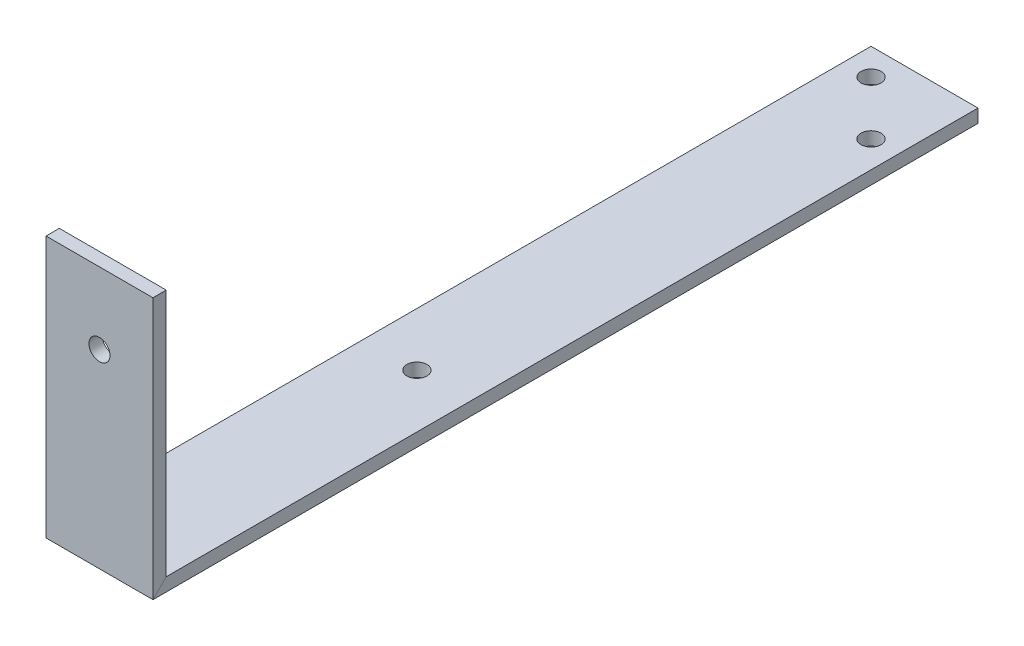
from build123d import *

# Parameters (mm, degrees)
CROQUIS2_W              = 50.8
CROQUIS2_H              = 6.31
CROQUIS3_W              = 50.8
CROQUIS3_H              = 6.31
CROQUIS4_W              = 60
CROQUIS4_H              = 53.155
SALIENTE_EXTRUIR1_DEPTH = 6.31
CROQUIS5_W              = 60
CROQUIS5_H              = 6.31
CORTAR_EXTRUIR1_DEPTH   = 6.31
CORTAR_EXTRUIR2_DEPTH   = 634
CROQUIS8_W              = 50.8
CROQUIS8_H              = 6.31
SALIENTE_EXTRUIR2_DEPTH = 63.5
CROQUIS9_R              = 5
CORTAR_EXTRUIR3_DEPTH   = 10
CROQUIS10_W             = 790.847933
CROQUIS10_H             = 6.31
CORTAR_EXTRUIR4_DEPTH   = 286
CROQUIS11_W             = 50.8
CROQUIS11_H             = 6.31
CROQUIS11_W_2           = 210
CORTAR_EXTRUIR5_DEPTH   = 13.11
CROQUIS12_W             = 50.8
CROQUIS12_H             = 6.31
SALIENTE_EXTRUIR3_DEPTH = 6.35
CROQUIS13_W             = 50.8
CROQUIS13_H             = 6.35
CORTAR_EXTRUIR6_DEPTH   = 6.35
CROQUIS14_W             = 85.847108528
CROQUIS14_H             = 473.639219469
CORTAR_EXTRUIR7_DEPTH   = 137
CROQUIS15_R             = 4.7625
CORTAR_EXTRUIR8_DEPTH   = 33
CROQUIS16_R             = 5
CORTAR_EXTRUIR9_DEPTH   = 33
CROQUIS18_R             = 4.7625
CORTAR_EXTRUIR10_DEPTH  = 50


with BuildPart() as part:
    # Barrer1: sweep along a curve in space
    with BuildLine() as barrer1_path:
        Line((0, 0, 0), (0, -567.24, 0))
        Line((0, -567.24, 0), (0, -567.24, 336.2))
        Line((0, -567.24, 336.2), (1786.7, -567.24, 336.2))
        Line((1786.7, -567.24, 336.2), (1786.7, -567.24, 693.16))
        Line((1786.7, -567.24, 693.16), (1786.7, -436.23, 693.16))
        Line((1786.7, -436.23, 693.16), (1786.7, -436.23, 1487.162933))
    # Croquis2 → Barrer1 (sweep)
    with BuildSketch(Plane(origin=(0, 0, 0), x_dir=(1, 0, 0), z_dir=(0, 1, 0))):
        Rectangle(CROQUIS2_W, CROQUIS2_H)
        with Locations((210, 0)):
            Rectangle(CROQUIS2_W, CROQUIS2_H)
    sweep(path=barrer1_path.line, transition=Transition.RIGHT)

    # Barrer4: sweep along a curve in space
    with BuildLine() as barrer4_path:
        Line((-0.201028049, -3.155, -3.155), (-0.201028049, -3.155, -207.155))
        Line((-0.201028049, -3.155, -207.155), (-0.201028049, -53.155, -207.155))
    # Croquis3 → Barrer4 (sweep)
    with BuildSketch(Plane(origin=(0, 0, -3.155), x_dir=(-1, 0, 0), z_dir=(0, 0, -1))):
        with Locations((-210, -3.155)):
            Rectangle(CROQUIS3_W, CROQUIS3_H)
        with Locations((0, -3.155)):
            Rectangle(CROQUIS3_W, CROQUIS3_H)
    sweep(path=barrer4_path.line, transition=Transition.RIGHT)

    # Croquis4 → Saliente-Extruir1 (add)
    with BuildSketch(Plane(origin=(0, 0, -210.31), x_dir=(-1, 0, 0), z_dir=(0, 0, -1))):
        with Locations((-154.6, -26.5775)):
            Rectangle(CROQUIS4_W, CROQUIS4_H)
    extrude(amount=-SALIENTE_EXTRUIR1_DEPTH)

    # Croquis5 → Cortar-Extruir1 (cut)
    with BuildSketch(Plane.XY.offset(-204)):
        with Locations((154.6, -3.155)):
            Rectangle(CROQUIS5_W, CROQUIS5_H)
    extrude(amount=-CORTAR_EXTRUIR1_DEPTH, mode=Mode.SUBTRACT)

    # Croquis7 → Cortar-Extruir2 (cut)
    with BuildSketch(Plane(origin=(0, 0, 0), x_dir=(1, 0, 0), z_dir=(0, 1, 0))):
        Polygon((1761.3, -361.6), (2022.1, -361.6), (2022.1, 278.600557529), (-188.115947115, 278.600557529), (-188.115947115, -361.6), align=None)
    extrude(amount=-CORTAR_EXTRUIR2_DEPTH, mode=Mode.SUBTRACT)

    # Croquis8 → Saliente-Extruir2 (add)
    with BuildSketch(Plane(origin=(0, 0, 361.6), x_dir=(-1, 0, 0), z_dir=(0, 0, -1))):
        with Locations((-1786.7, -567.24)):
            Rectangle(CROQUIS8_W, CROQUIS8_H)
    extrude(amount=SALIENTE_EXTRUIR2_DEPTH)

    # Croquis9 → Cortar-Extruir3 (cut)
    with BuildSketch(Plane(origin=(0, -433.075, 0), x_dir=(1, 0, 0), z_dir=(0, 1, 0))):
        with Locations(Location((1786.7, -1454.162933, 0), (0, 0, 270))):
            Circle(CROQUIS9_R)
        with Locations(Location((1786.7, -1234.162933, 0), (0, 0, 270))):
            Circle(CROQUIS9_R)
        with Locations(Location((1996.7, -1234.162933, 0), (0, 0, 270))):
            Circle(CROQUIS9_R)
        with Locations(Location((1996.7, -1454.162933, 0), (0, 0, 270))):
            Circle(CROQUIS9_R)
    extrude(amount=-CORTAR_EXTRUIR3_DEPTH, mode=Mode.SUBTRACT)

    # Croquis10 → Cortar-Extruir4 (cut)
    with BuildSketch(Plane(origin=(2022.1, 0, 0), x_dir=(0, 0, -1), z_dir=(1, 0, 0))):
        with Locations((-1091.7389665, -436.23)):
            Rectangle(CROQUIS10_W, CROQUIS10_H)
    extrude(amount=-CORTAR_EXTRUIR4_DEPTH, mode=Mode.SUBTRACT)

    # Croquis11 → Cortar-Extruir5 (cut)
    with BuildSketch(Plane(origin=(0, -433.075, 0), x_dir=(1, 0, 0), z_dir=(0, 1, 0))):
        with Locations((1996.7, -693.16)):
            Rectangle(CROQUIS11_W, CROQUIS11_H)
        with Locations((1866.3, -693.16)):
            Rectangle(CROQUIS11_W_2, CROQUIS11_H)
    extrude(amount=-CORTAR_EXTRUIR5_DEPTH, mode=Mode.SUBTRACT)

    # Croquis12 → Saliente-Extruir3 (add)
    with BuildSketch(Plane(origin=(0, 0, 361.6), x_dir=(-1, 0, 0), z_dir=(0, 0, -1))):
        with Locations((-1996.7, -567.24)):
            Rectangle(CROQUIS12_W, CROQUIS12_H)
    extrude(amount=SALIENTE_EXTRUIR3_DEPTH)

    # Croquis13 → Cortar-Extruir6 (cut)
    with BuildSketch(Plane(origin=(0, -564.085, 0), x_dir=(1, 0, 0), z_dir=(0, 1, 0))):
        with Locations((1786.7, -301.275)):
            Rectangle(CROQUIS13_W, CROQUIS13_H)
    extrude(amount=-CORTAR_EXTRUIR6_DEPTH, mode=Mode.SUBTRACT)

    # Croquis14 → Cortar-Extruir7 (cut)
    with BuildSketch(Plane(origin=(0, -446.185, 0), x_dir=(1, 0, 0), z_dir=(0, 1, 0))):
        with Locations((1999.254154868, -571.717300183)):
            Rectangle(CROQUIS14_W, CROQUIS14_H)
    extrude(amount=-CORTAR_EXTRUIR7_DEPTH, mode=Mode.SUBTRACT)

    # Croquis15 → Cortar-Extruir8 (cut)
    with BuildSketch(Plane(origin=(0, -564.085, 0), x_dir=(1, 0, 0), z_dir=(0, 1, 0))):
        with Locations(Location((1786.7, -545.545, 0), (0, 0, 270))):
            Circle(CROQUIS15_R)
    extrude(amount=-CORTAR_EXTRUIR8_DEPTH, mode=Mode.SUBTRACT)

    # Croquis16 → Cortar-Extruir9 (cut)
    with BuildSketch(Plane(origin=(0, 0, 690.005), x_dir=(-1, 0, 0), z_dir=(0, 0, -1))):
        with Locations((-1786.7, -480.185)):
            Circle(CROQUIS16_R)
    extrude(amount=-CORTAR_EXTRUIR9_DEPTH, mode=Mode.SUBTRACT)

    # Croquis18 → Cortar-Extruir10 (cut)
    with BuildSketch(Plane(origin=(0, -570.395, 0), x_dir=(-1, 0, 0), z_dir=(0, -1, 0))):
        with Locations(Location((-1799.399999999, -342.552204666, 0), (0, 0, 90))):
            Circle(CROQUIS18_R)
        with Locations(Location((-1773.999999999, -317.152204666, 0), (0, 0, 90))):
            Circle(CROQUIS18_R)
    extrude(amount=-CORTAR_EXTRUIR10_DEPTH, mode=Mode.SUBTRACT)


solid = part.part
